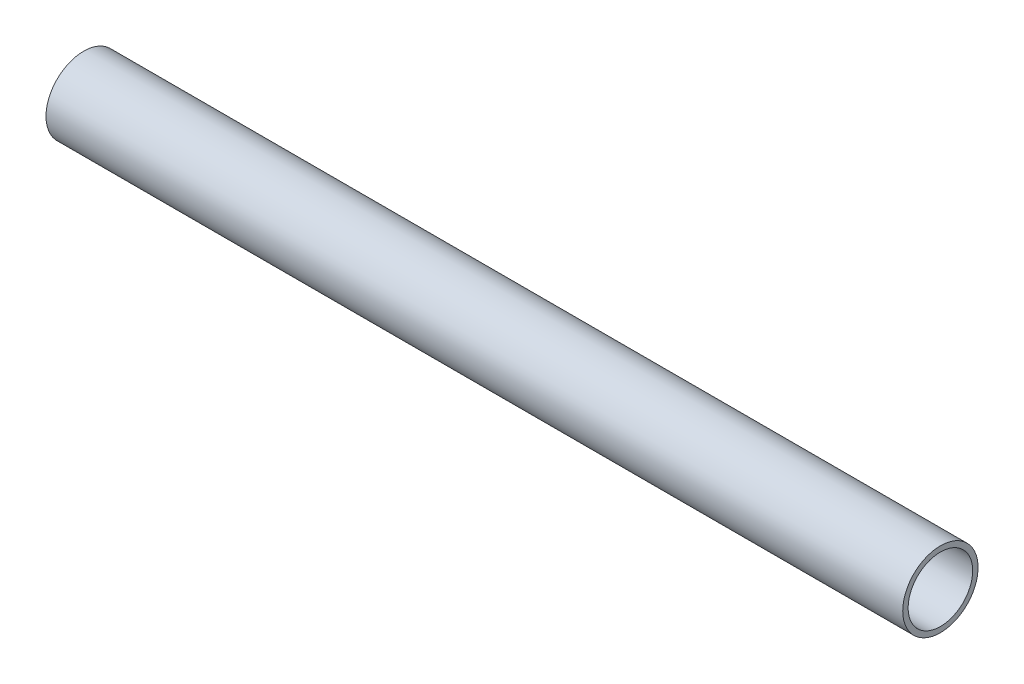
from build123d import *

# Parameters (mm, degrees)
IZIM1_R                     = 7
IZIM1_R_2                   = 6
Y_KSEKLIK_EKSTR_ZYON1_DEPTH = 79.6


with BuildPart() as part:
    # Çizim1 → Yükseklik-Ekstrüzyon1 (new, symmetric)
    with BuildSketch(Plane(origin=(0, 0, 0), x_dir=(0, 0, -1), z_dir=(1, 0, 0))):
        with Locations(Location((0, 0, 0), (0, 0, 180))):
            Circle(IZIM1_R)
        with Locations(Location((0, 0, 0), (0, 0, 180))):
            Circle(IZIM1_R_2, mode=Mode.SUBTRACT)
    extrude(amount=Y_KSEKLIK_EKSTR_ZYON1_DEPTH, both=True)


solid = part.part
